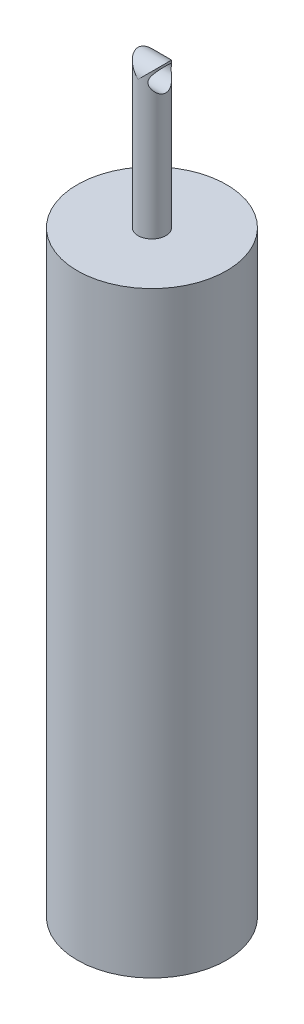
from build123d import *

# Parameters (mm, degrees)
SKETCH1_R               = 25.4
BOSS_EXTRUDE1_DEPTH     = 203.2
SKETCH2_R               = 4.73075
BOSS_EXTRUDE2_DEPTH     = 50.8
CUT_EXTRUDE1_DEPTH      = 257.527425434
CUT_EXTRUDE1_DEPTH_BACK = 257.527425434
SKETCH3_R               = 3.96875


with BuildPart() as part:
    # Sketch1 → Boss-Extrude1 (new body)
    with BuildSketch(Plane(origin=(0, 0, 0), x_dir=(1, 0, 0), z_dir=(0, 1, 0))):
        with Locations(Location((0, 0, 0), (0, 0, 270))):
            Circle(SKETCH1_R)
    extrude(amount=BOSS_EXTRUDE1_DEPTH)

    # Sketch2 → Boss-Extrude2 (add)
    with BuildSketch(Plane(origin=(0, 203.2, 0), x_dir=(1, 0, 0), z_dir=(0, 1, 0))):
        with Locations(Location((0, 0, 0), (0, 0, 270))):
            Circle(SKETCH2_R)
    extrude(amount=BOSS_EXTRUDE2_DEPTH)

    # Sketch3 → Cut-Extrude1 (cut, two sides: drawn at the far end of the back side and taken through both)
    with BuildSketch(Plane(origin=(0, 0, 0), x_dir=(0, 0, -1), z_dir=(1, 0, 0)).offset(-CUT_EXTRUDE1_DEPTH_BACK)):
        with Locations((0, 249.26925)):
            Circle(SKETCH3_R)
        with BuildLine():
            Line((-4.73075, 254), (-4.73075, 249.26925))
            ThreePointArc((-4.73075, 249.26925), (-3.345145405, 252.614395405), (0, 254))
            Line((0, 254), (-4.73075, 254))
        make_face()
        with BuildLine():
            ThreePointArc((0, 254), (3.345145405, 252.614395405), (4.73075, 249.26925))
            Line((4.73075, 249.26925), (4.73075, 254))
            Line((4.73075, 254), (0, 254))
        make_face()
    extrude(amount=CUT_EXTRUDE1_DEPTH + CUT_EXTRUDE1_DEPTH_BACK, mode=Mode.SUBTRACT)


solid = part.part
